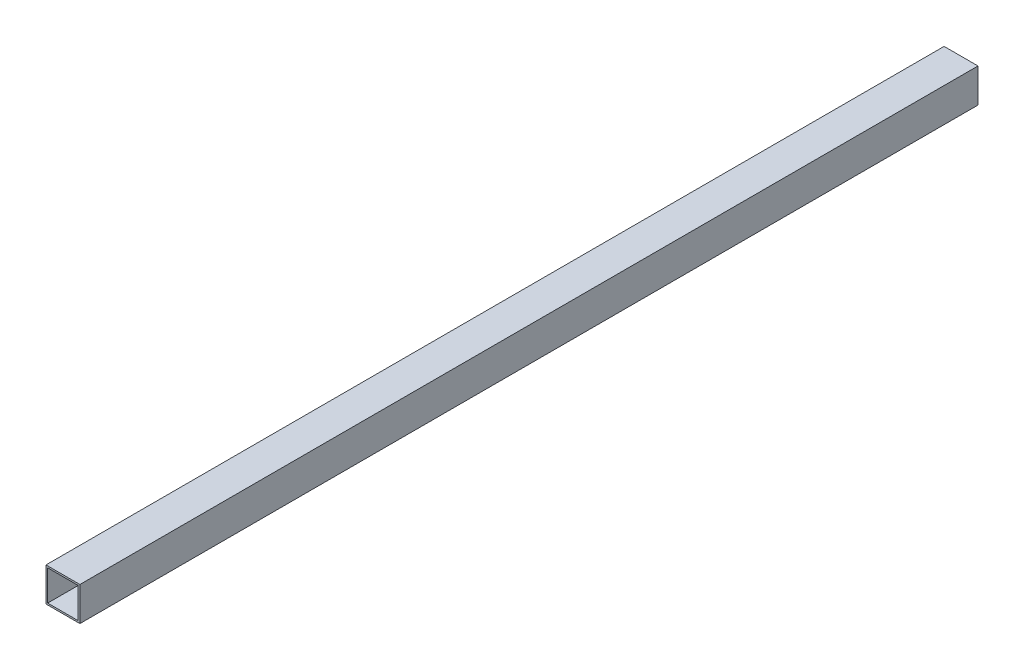
from build123d import *

# Parameters (mm, degrees)
CROQUIS1_W            = 40
CROQUIS1_H            = 40
CROQUIS1_W_2          = 36
CROQUIS1_H_2          = 36
EXTRUIR_L_MINA1_DEPTH = 1060


with BuildPart() as part:
    # Croquis1 → Extruir-Lámina1 (new body)
    with BuildSketch(Plane.XY):
        Rectangle(CROQUIS1_W, CROQUIS1_H)
        Rectangle(CROQUIS1_W_2, CROQUIS1_H_2, mode=Mode.SUBTRACT)
    extrude(amount=EXTRUIR_L_MINA1_DEPTH)


solid = part.part
